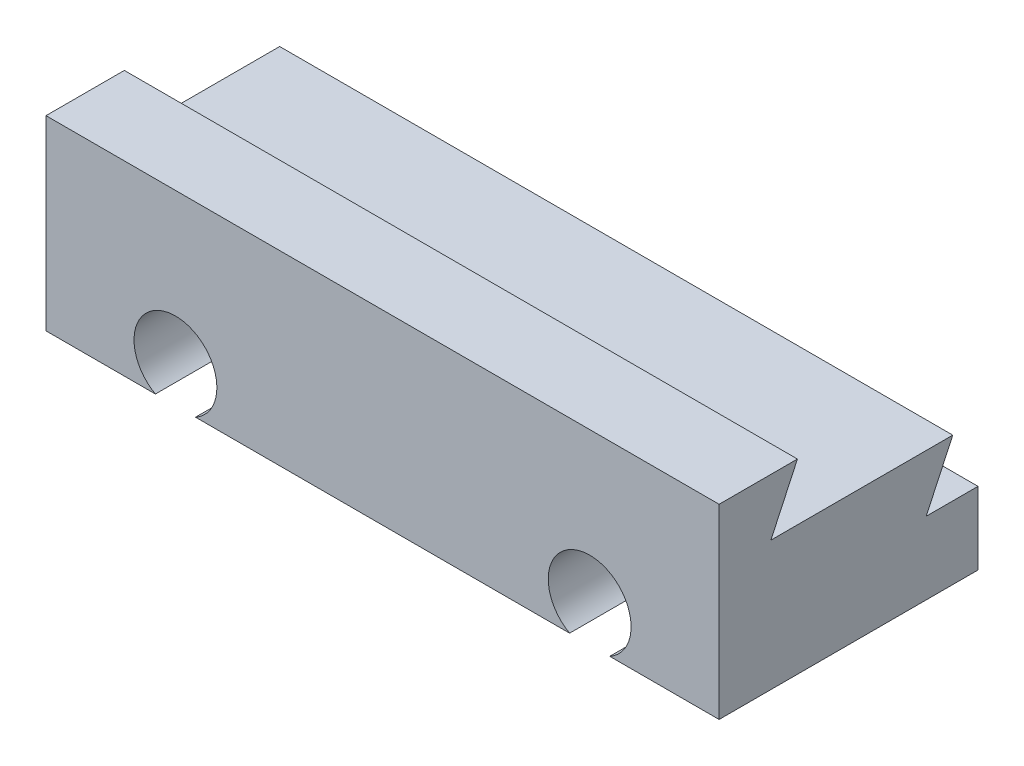
from build123d import *

# Parameters (mm, degrees)
BOSS_EXTRUDE1_DEPTH = 65
SKETCH2_R           = 2.1
CUT_EXTRUDE1_DEPTH  = 25
SKETCH3_R           = 4
CUT_EXTRUDE2_DEPTH  = 15


with BuildPart() as part:
    # Sketch1 → Boss-Extrude1 (new body)
    with BuildSketch(Plane(origin=(0, 0, 0), x_dir=(0, 0, -1), z_dir=(1, 0, 0))):
        Polygon((0, 0), (0, 18), (7.56469212, 18), (5, 12.5), (22.56469212, 12.5), (20, 7), (25, 7), (25, 0), align=None)
    extrude(amount=BOSS_EXTRUDE1_DEPTH)

    # Sketch2 → Cut-Extrude1 (cut)
    with BuildSketch(Plane(origin=(0, 0, -25), x_dir=(-1, 0, 0), z_dir=(0, 0, -1))):
        with Locations((-12.5, 3.5)):
            Circle(SKETCH2_R)
        with Locations((-52.5, 3.5)):
            Circle(SKETCH2_R)
    extrude(amount=-CUT_EXTRUDE1_DEPTH, mode=Mode.SUBTRACT)

    # Sketch3 → Cut-Extrude2 (cut)
    with BuildSketch(Plane.XY):
        with Locations((12.5, 3.5)):
            Circle(SKETCH3_R)
        with Locations((52.5, 3.5)):
            Circle(SKETCH3_R)
    extrude(amount=-CUT_EXTRUDE2_DEPTH, mode=Mode.SUBTRACT)


solid = part.part
